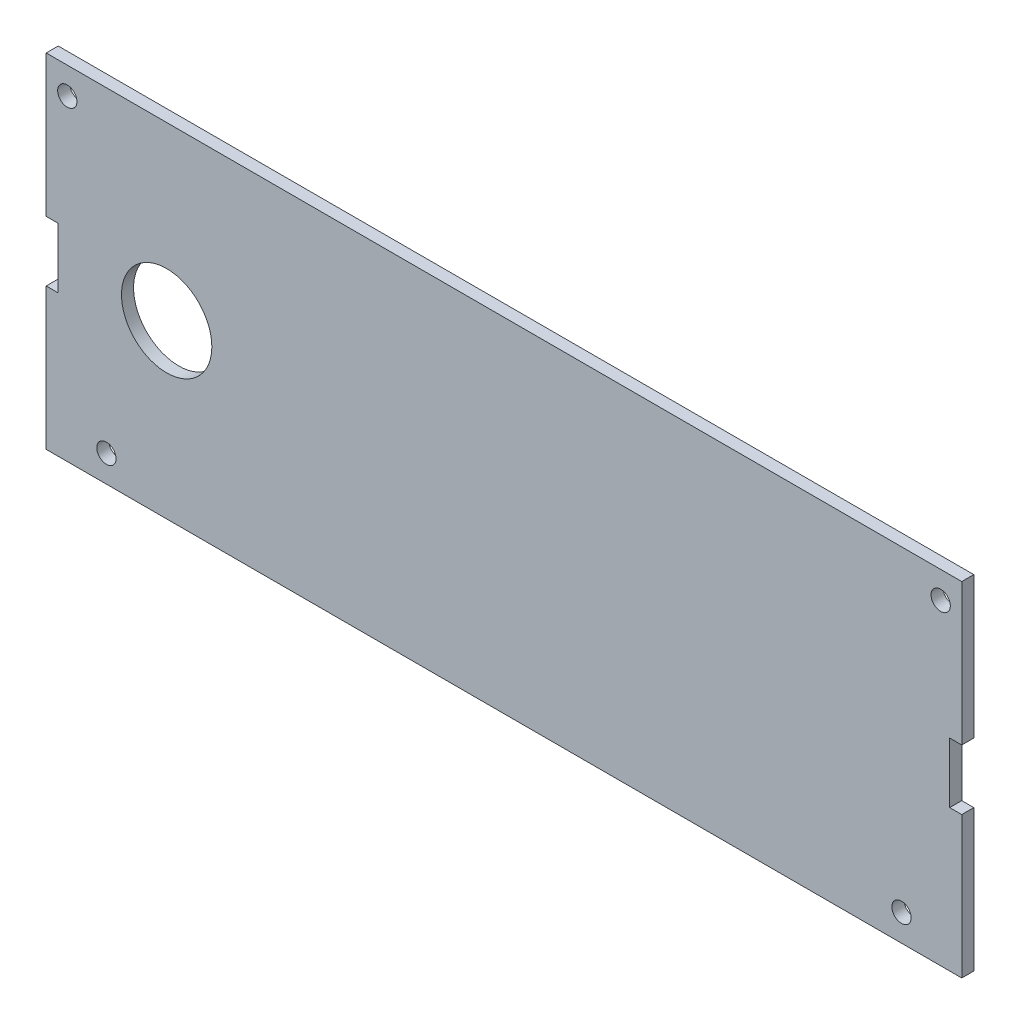
from build123d import *

# Parameters (mm, degrees)
BOSS_EXTRUDE1_DEPTH = 2
SKETCH2_R           = 1.6
SKETCH2_R_2         = 7.5
CUT_EXTRUDE1_DEPTH  = 82.192672083


with BuildPart() as part:
    # Sketch1 → Boss-Extrude1 (new body)
    with BuildSketch(Plane.XY):
        Polygon((76, 28.5), (-76, 28.5), (-76, 5), (-74, 5), (-74, -5), (-76, -5), (-76, -28.5), (76, -28.5), (76, -5), (74, -5), (74, 5), (76, 5), align=None)
    extrude(amount=BOSS_EXTRUDE1_DEPTH)

    # Sketch2 → Cut-Extrude1 (cut, through all)
    with BuildSketch(Plane.XY.offset(2)):
        with Locations((-72.5, 24.05)):
            Circle(SKETCH2_R)
        with Locations((72.5, 24.05)):
            Circle(SKETCH2_R)
        with Locations((66, -24.05)):
            Circle(SKETCH2_R)
        with Locations((-66, -24.05)):
            Circle(SKETCH2_R)
        with Locations((-56, 0)):
            Circle(SKETCH2_R_2)
    extrude(amount=-CUT_EXTRUDE1_DEPTH, mode=Mode.SUBTRACT)


solid = part.part
